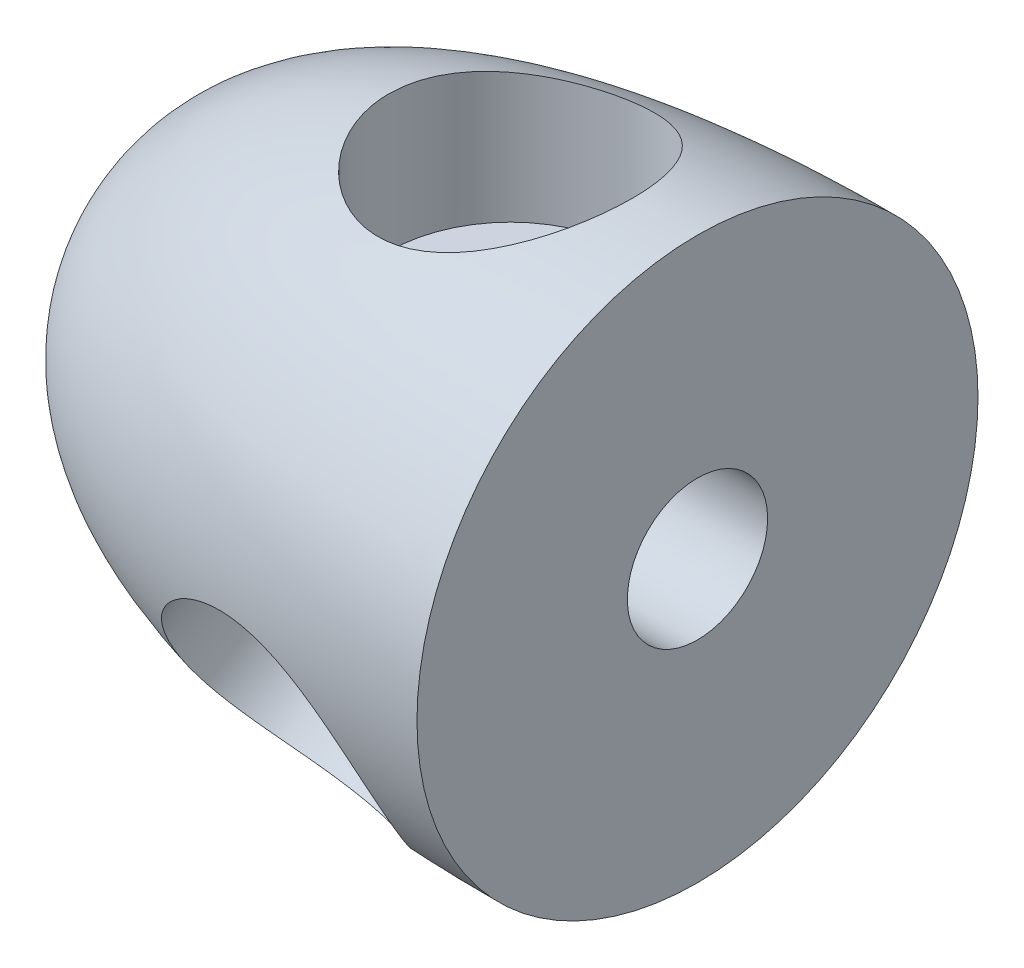
from build123d import *

# Parameters (mm, degrees)
SKETCH3_R          = 4.7625
CUT_EXTRUDE1_DEPTH = 12.7
SKETCH4_R          = 8.255
CUT_EXTRUDE2_DEPTH = 21.844
CIRPATTERN1_COUNT  = 3


with BuildPart() as part:
    # Sketch2 → Revolve1 (revolve)
    with BuildSketch(Plane.XY):
        with BuildLine():
            Line((0, 0), (-38.1, 0))
            add(Edge.make_bspline(
                [(0, 19.05), (-14.199031657, 19.05), (-38.1, 16.933744176), (-38.1, 0)],
                knots=[0, 0, 0, 0, 1, 1, 1, 1], degree=3))
            Line((0, 19.05), (0, 0))
        make_face()
    revolve(axis=Axis((0, 0, 0), (-1, 0, 0)))

    # Sketch3 → Cut-Extrude1 (cut)
    with BuildSketch(Plane(origin=(0, 0, 0), x_dir=(0, 0, -1), z_dir=(1, 0, 0))):
        Circle(SKETCH3_R)
    extrude(amount=-CUT_EXTRUDE1_DEPTH, mode=Mode.SUBTRACT)

    # Sketch4 → Cut-Extrude2 (cut)
    with BuildSketch(Plane(origin=(0, 7.62, 0), x_dir=(1, 0, 0), z_dir=(0, 1, 0))):
        with Locations((-12.7, 0)):
            Circle(SKETCH4_R)
    cut_extrude2 = extrude(amount=CUT_EXTRUDE2_DEPTH, mode=Mode.SUBTRACT)

    # CirPattern1: Cut-Extrude2 ×3 about axis
    cirpattern1_axis = Axis((0, 0, 0), (1, 0, 0))
    for i in range(1, CIRPATTERN1_COUNT):
        add(cut_extrude2.rotate(cirpattern1_axis, i * 360 / CIRPATTERN1_COUNT), mode=Mode.SUBTRACT)


solid = part.part
